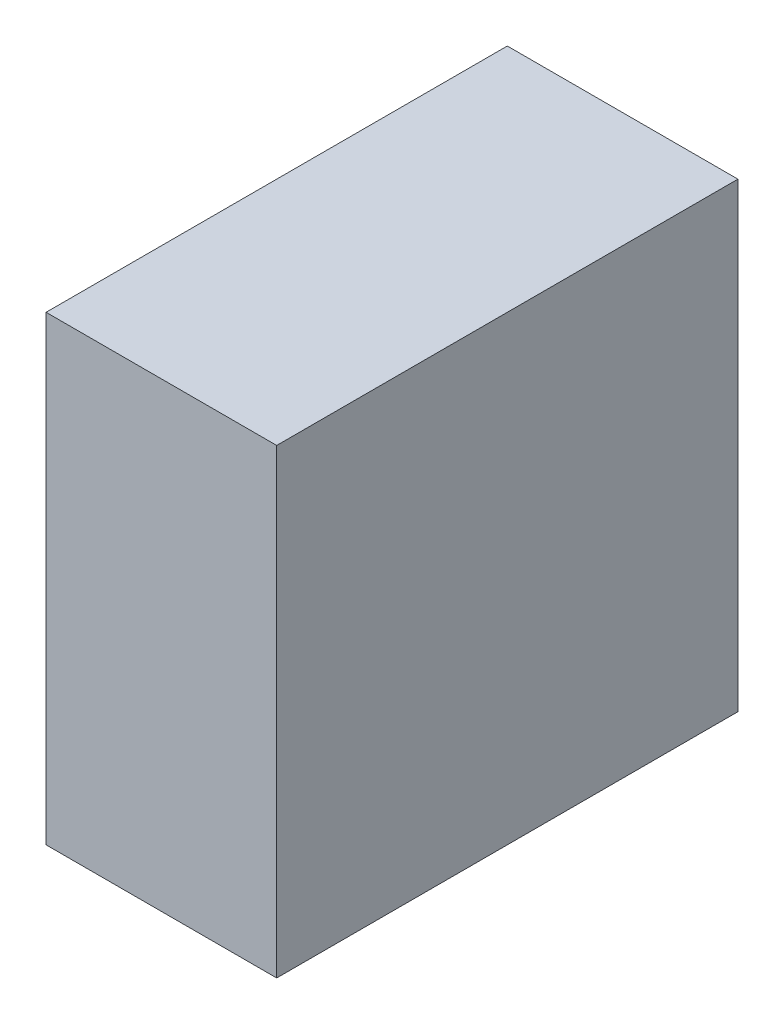
from build123d import *

# Parameters (mm, degrees)
SKETCH1_W           = 30
SKETCH1_H           = 60
BOSS_EXTRUDE1_DEPTH = 30


with BuildPart() as part:
    # Sketch1 → Boss-Extrude1 (new, symmetric)
    with BuildSketch(Plane.XY):
        Rectangle(SKETCH1_W, SKETCH1_H)
    extrude(amount=BOSS_EXTRUDE1_DEPTH, both=True)


solid = part.part
